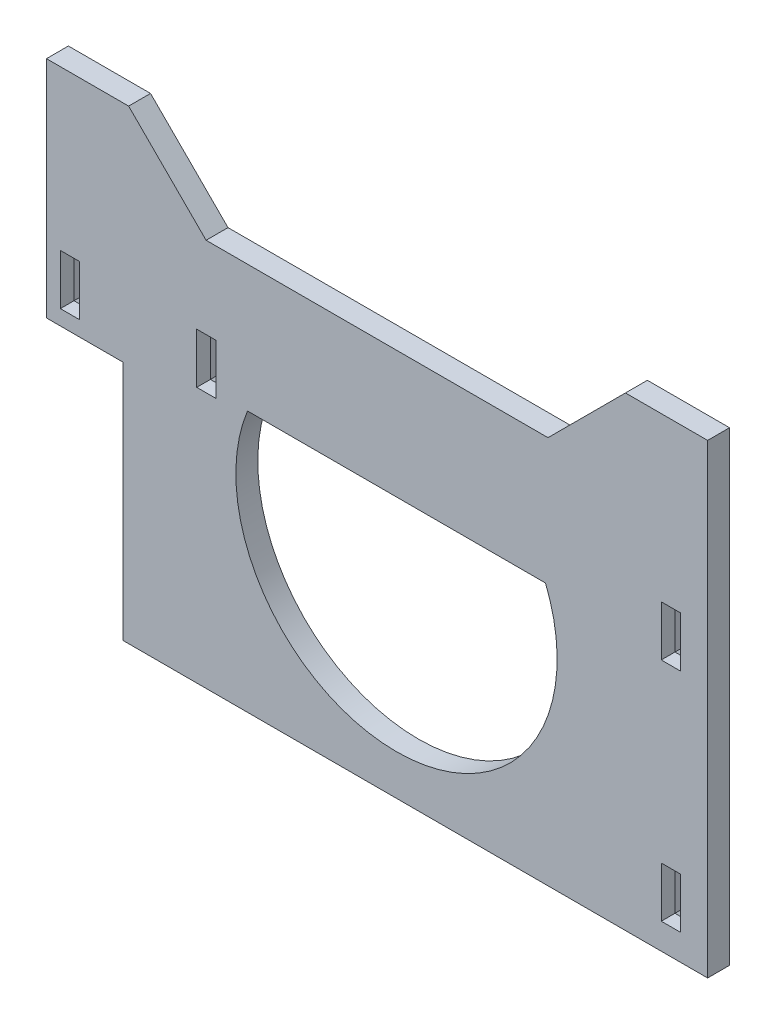
from build123d import *
from OCP.BRepFilletAPI import BRepFilletAPI_MakeChamfer

# Parameters (mm, degrees)
SKETCH1_W           = 3.53
SKETCH1_H           = 9.2
BOSS_EXTRUDE1_DEPTH = 4
BOSS_EXTRUDE2_DEPTH = 4
CHAMFER1_SIZE       = 1.5
CHAMFER1_SIZE2      = 0.5


with BuildPart() as part:
    # Sketch1 → Boss-Extrude1 (new body)
    with BuildSketch(Plane.XY):
        Polygon((52.4925, 30), (52.4925, -30), (-54.2075, -30), (-54.2075, 14), (-68.2075, 14), (-68.2075, 30), align=None)
        with BuildLine():
            Line((-31.510630119, 17.647843267), (22.89855475, 17.647843267))
            ThreePointArc((22.89855475, 17.647843267), (-4.306037684, -22.627990687), (-31.510630119, 17.647843267))
        make_face(mode=Mode.SUBTRACT)
        with Locations((-39.0075, 21.35)):
            Rectangle(SKETCH1_W, SKETCH1_H, mode=Mode.SUBTRACT)
        with Locations((45.7925, 20.65)):
            Rectangle(SKETCH1_W, SKETCH1_H, mode=Mode.SUBTRACT)
        with Locations((45.8, -20.65)):
            Rectangle(SKETCH1_W, SKETCH1_H, mode=Mode.SUBTRACT)
        with Locations((-63.9075, 21.35)):
            Rectangle(SKETCH1_W, SKETCH1_H, mode=Mode.SUBTRACT)
    extrude(amount=BOSS_EXTRUDE1_DEPTH)

    # Sketch2 → Boss-Extrude2 (add)
    with BuildSketch(Plane.XY):
        Polygon((-68.2075, 30), (52.4925, 30), (52.4925, 55), (37.4925, 55), (23.350364376, 40.857864376), (-39.065364376, 40.857864376), (-53.2075, 55), (-68.2075, 55), align=None)
    extrude(amount=BOSS_EXTRUDE2_DEPTH)

    # Chamfer1: one chamfer whose edges measure the first distance from different faces: ONE call of the kernel's chamfer builder (chamfer() names one face for all edges)
    chamfer1_edges_1 = [part.edges().sort_by_distance(p)[0] for p in [
        (-40.7725, 21.35, 0),
    ]]
    chamfer1_side_1 = [part.faces().sort_by_distance(p)[0] for p in [
        (-40.7725, 21.35, 2),
    ]]
    chamfer1_edges_2 = [part.edges().sort_by_distance(p)[0] for p in [
        (-39.0075, 16.75, 0),
    ]]
    chamfer1_side_2 = [part.faces().sort_by_distance(p)[0] for p in [
        (-39.0075, 16.75, 2),
    ]]
    chamfer1_edges_3 = [part.edges().sort_by_distance(p)[0] for p in [
        (-37.2425, 21.35, 0),
    ]]
    chamfer1_side_3 = [part.faces().sort_by_distance(p)[0] for p in [
        (-37.2425, 21.35, 2),
    ]]
    chamfer1_edges_4 = [part.edges().sort_by_distance(p)[0] for p in [
        (-39.0075, 25.95, 0),
    ]]
    chamfer1_side_4 = [part.faces().sort_by_distance(p)[0] for p in [
        (-39.0075, 25.95, 2),
    ]]
    chamfer1_edges_5 = [part.edges().sort_by_distance(p)[0] for p in [
        (-65.6725, 21.35, 0),
    ]]
    chamfer1_side_5 = [part.faces().sort_by_distance(p)[0] for p in [
        (-65.6725, 21.35, 2),
    ]]
    chamfer1_edges_6 = [part.edges().sort_by_distance(p)[0] for p in [
        (-63.9075, 16.75, 0),
    ]]
    chamfer1_side_6 = [part.faces().sort_by_distance(p)[0] for p in [
        (-63.9075, 16.75, 2),
    ]]
    chamfer1_edges_7 = [part.edges().sort_by_distance(p)[0] for p in [
        (-62.1425, 21.35, 0),
    ]]
    chamfer1_side_7 = [part.faces().sort_by_distance(p)[0] for p in [
        (-62.1425, 21.35, 2),
    ]]
    chamfer1_edges_8 = [part.edges().sort_by_distance(p)[0] for p in [
        (-63.9075, 25.95, 0),
    ]]
    chamfer1_side_8 = [part.faces().sort_by_distance(p)[0] for p in [
        (-63.9075, 25.95, 2),
    ]]
    chamfer1_edges_9 = [part.edges().sort_by_distance(p)[0] for p in [
        (44.0275, 20.65, 0),
    ]]
    chamfer1_side_9 = [part.faces().sort_by_distance(p)[0] for p in [
        (44.0275, 20.65, 2),
    ]]
    chamfer1_edges_10 = [part.edges().sort_by_distance(p)[0] for p in [
        (45.7925, 16.05, 0),
    ]]
    chamfer1_side_10 = [part.faces().sort_by_distance(p)[0] for p in [
        (45.7925, 16.05, 2),
    ]]
    chamfer1_edges_11 = [part.edges().sort_by_distance(p)[0] for p in [
        (47.5575, 20.65, 0),
    ]]
    chamfer1_side_11 = [part.faces().sort_by_distance(p)[0] for p in [
        (47.5575, 20.65, 2),
    ]]
    chamfer1_edges_12 = [part.edges().sort_by_distance(p)[0] for p in [
        (45.7925, 25.25, 0),
    ]]
    chamfer1_side_12 = [part.faces().sort_by_distance(p)[0] for p in [
        (45.7925, 25.25, 2),
    ]]
    chamfer1_edges_13 = [part.edges().sort_by_distance(p)[0] for p in [
        (47.565, -20.65, 0),
    ]]
    chamfer1_side_13 = [part.faces().sort_by_distance(p)[0] for p in [
        (47.565, -20.65, 2),
    ]]
    chamfer1_edges_14 = [part.edges().sort_by_distance(p)[0] for p in [
        (45.8, -16.05, 0),
    ]]
    chamfer1_side_14 = [part.faces().sort_by_distance(p)[0] for p in [
        (45.8, -16.05, 2),
    ]]
    chamfer1_edges_15 = [part.edges().sort_by_distance(p)[0] for p in [
        (44.035, -20.65, 0),
    ]]
    chamfer1_side_15 = [part.faces().sort_by_distance(p)[0] for p in [
        (44.035, -20.65, 2),
    ]]
    chamfer1_edges_16 = [part.edges().sort_by_distance(p)[0] for p in [
        (45.8, -25.25, 0),
    ]]
    chamfer1_side_16 = [part.faces().sort_by_distance(p)[0] for p in [
        (45.8, -25.25, 2),
    ]]
    chamfer1 = BRepFilletAPI_MakeChamfer(part.part.solid().wrapped)
    for e in chamfer1_edges_1:
        chamfer1.Add(CHAMFER1_SIZE, CHAMFER1_SIZE2, e.wrapped, chamfer1_side_1[0].wrapped)  # the first distance lies on this face
    for e in chamfer1_edges_2:
        chamfer1.Add(CHAMFER1_SIZE, CHAMFER1_SIZE2, e.wrapped, chamfer1_side_2[0].wrapped)  # the first distance lies on this face
    for e in chamfer1_edges_3:
        chamfer1.Add(CHAMFER1_SIZE, CHAMFER1_SIZE2, e.wrapped, chamfer1_side_3[0].wrapped)  # the first distance lies on this face
    for e in chamfer1_edges_4:
        chamfer1.Add(CHAMFER1_SIZE, CHAMFER1_SIZE2, e.wrapped, chamfer1_side_4[0].wrapped)  # the first distance lies on this face
    for e in chamfer1_edges_5:
        chamfer1.Add(CHAMFER1_SIZE, CHAMFER1_SIZE2, e.wrapped, chamfer1_side_5[0].wrapped)  # the first distance lies on this face
    for e in chamfer1_edges_6:
        chamfer1.Add(CHAMFER1_SIZE, CHAMFER1_SIZE2, e.wrapped, chamfer1_side_6[0].wrapped)  # the first distance lies on this face
    for e in chamfer1_edges_7:
        chamfer1.Add(CHAMFER1_SIZE, CHAMFER1_SIZE2, e.wrapped, chamfer1_side_7[0].wrapped)  # the first distance lies on this face
    for e in chamfer1_edges_8:
        chamfer1.Add(CHAMFER1_SIZE, CHAMFER1_SIZE2, e.wrapped, chamfer1_side_8[0].wrapped)  # the first distance lies on this face
    for e in chamfer1_edges_9:
        chamfer1.Add(CHAMFER1_SIZE, CHAMFER1_SIZE2, e.wrapped, chamfer1_side_9[0].wrapped)  # the first distance lies on this face
    for e in chamfer1_edges_10:
        chamfer1.Add(CHAMFER1_SIZE, CHAMFER1_SIZE2, e.wrapped, chamfer1_side_10[0].wrapped)  # the first distance lies on this face
    for e in chamfer1_edges_11:
        chamfer1.Add(CHAMFER1_SIZE, CHAMFER1_SIZE2, e.wrapped, chamfer1_side_11[0].wrapped)  # the first distance lies on this face
    for e in chamfer1_edges_12:
        chamfer1.Add(CHAMFER1_SIZE, CHAMFER1_SIZE2, e.wrapped, chamfer1_side_12[0].wrapped)  # the first distance lies on this face
    for e in chamfer1_edges_13:
        chamfer1.Add(CHAMFER1_SIZE, CHAMFER1_SIZE2, e.wrapped, chamfer1_side_13[0].wrapped)  # the first distance lies on this face
    for e in chamfer1_edges_14:
        chamfer1.Add(CHAMFER1_SIZE, CHAMFER1_SIZE2, e.wrapped, chamfer1_side_14[0].wrapped)  # the first distance lies on this face
    for e in chamfer1_edges_15:
        chamfer1.Add(CHAMFER1_SIZE, CHAMFER1_SIZE2, e.wrapped, chamfer1_side_15[0].wrapped)  # the first distance lies on this face
    for e in chamfer1_edges_16:
        chamfer1.Add(CHAMFER1_SIZE, CHAMFER1_SIZE2, e.wrapped, chamfer1_side_16[0].wrapped)  # the first distance lies on this face
    add(Compound.cast(chamfer1.Shape()), mode=Mode.REPLACE)


solid = part.part
